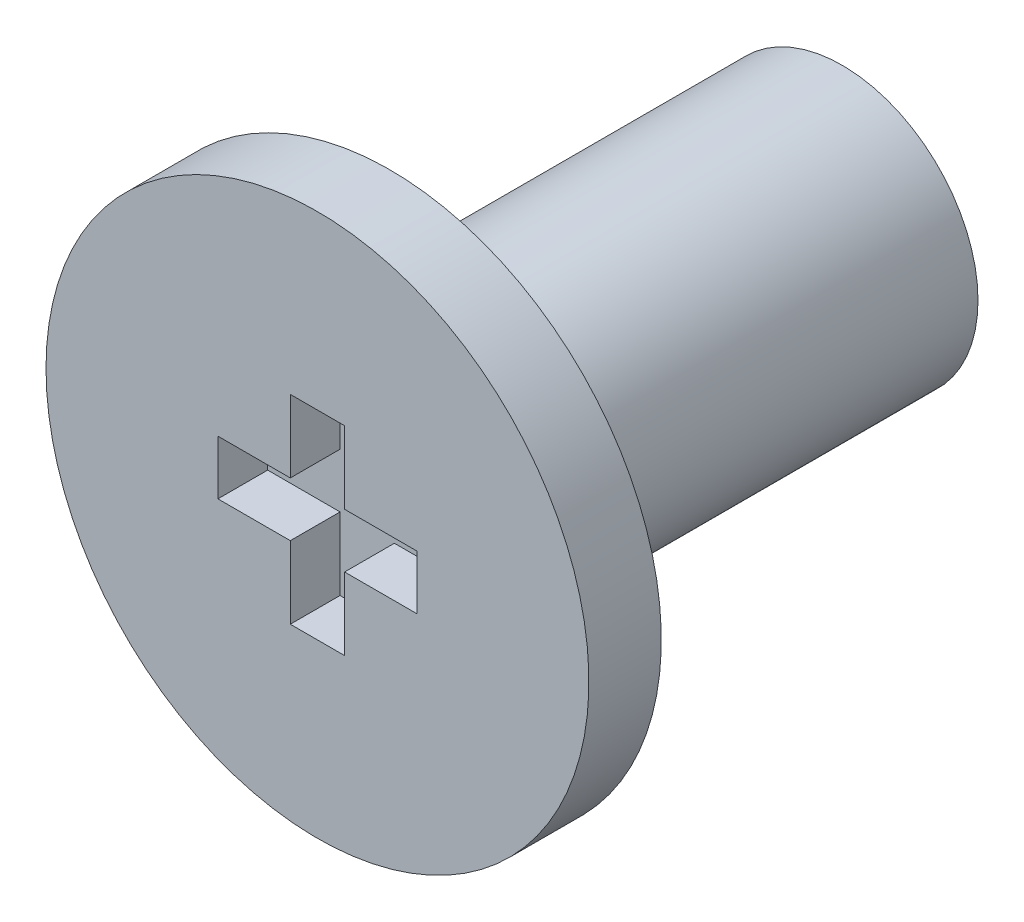
from build123d import *

# Parameters (mm, degrees)
SKETCH_1_R        = 1.5
EXTRUDE_198_DEPTH = 5
SKETCH_6_W        = 3
SKETCH_6_H        = 0.8
PH1_START         = 0.81
PH1_DEPTH         = 0.56


with BuildPart() as part:
    # 草图1 → Extrude 198 (new body)
    with BuildSketch(Plane.XY):
        Circle(SKETCH_1_R)
    extrude(amount=-EXTRUDE_198_DEPTH)

    # 草图6 → Revolve 324 (revolve)
    with BuildSketch(Plane(origin=(0, 0, 0), x_dir=(1, 0, 0), z_dir=(0, 1, 0)), mode=Mode.PRIVATE) as revolve_324_sk:
        with Locations((1.5, -0.4)):
            Rectangle(SKETCH_6_W, SKETCH_6_H)
    revolve(revolve_324_sk.sketch.rotate(Axis((0, 0, -2), (0, 0, 1)), 180), axis=Axis((0, 0, -2), (0, 0, 1)))

    # 草图7 → 十字槽_PH1_简化 (cut)
    with BuildSketch(Plane.XY.offset(PH1_START)):
        Polygon((-0.3, -1.1), (0.3, -1.1), (0.3, -0.3), (1.1, -0.3), (1.1, 0.3), (0.3, 0.3), (0.3, 1.1), (-0.3, 1.1), (-0.3, 0.3), (-1.1, 0.3), (-1.1, -0.3), (-0.3, -0.3), align=None)
    extrude(amount=-PH1_DEPTH, mode=Mode.SUBTRACT)


solid = part.part
